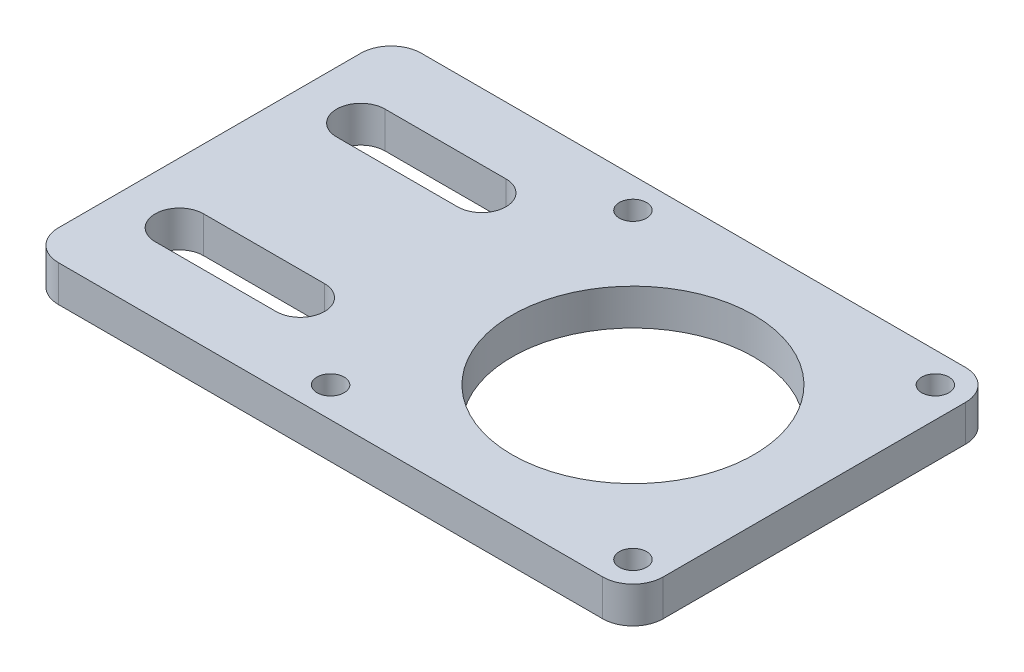
from build123d import *

# Parameters (mm, degrees)
SKETCH1_R           = 2.25
SKETCH1_R_2         = 20
BOSS_EXTRUDE1_DEPTH = 6


with BuildPart() as part:
    # Sketch1 → Boss-Extrude1 (new body)
    with BuildSketch(Plane(origin=(0, 0, 0), x_dir=(1, 0, 0), z_dir=(0, 1, 0))):
        with BuildLine():
            Line((0, -25), (0, 25))
            ThreePointArc((0, 25), (1.464466094, 28.535533906), (5, 30))
            Line((5, 30), (95, 30))
            ThreePointArc((95, 30), (98.535533906, 28.535533906), (100, 25))
            Line((100, 25), (100, -25))
            ThreePointArc((100, -25), (98.535533906, -28.535533906), (95, -30))
            Line((95, -30), (5, -30))
            ThreePointArc((5, -30), (1.464466094, -28.535533906), (0, -25))
        make_face()
        with Locations(Location((95, 25, 0), (0, 0, 270))):
            Circle(SKETCH1_R, mode=Mode.SUBTRACT)
        with Locations(Location((45, 25, 0), (0, 0, 270))):
            Circle(SKETCH1_R, mode=Mode.SUBTRACT)
        with Locations(Location((45, -25, 0), (0, 0, 90))):
            Circle(SKETCH1_R, mode=Mode.SUBTRACT)
        with Locations(Location((95, -25, 0), (0, 0, 90))):
            Circle(SKETCH1_R, mode=Mode.SUBTRACT)
        with Locations(Location((70, 0, 0), (0, 0, 270))):
            Circle(SKETCH1_R_2, mode=Mode.SUBTRACT)
        with BuildLine():
            Line((10, 19), (30, 19))
            ThreePointArc((30, 19), (34, 15), (30, 11))
            Line((30, 11), (10, 11))
            ThreePointArc((10, 11), (6, 15), (10, 19))
        make_face(mode=Mode.SUBTRACT)
        with BuildLine():
            Line((10, -19), (30, -19))
            ThreePointArc((30, -19), (34, -15), (30, -11))
            Line((30, -11), (10, -11))
            ThreePointArc((10, -11), (6, -15), (10, -19))
        make_face(mode=Mode.SUBTRACT)
    extrude(amount=BOSS_EXTRUDE1_DEPTH)


solid = part.part
